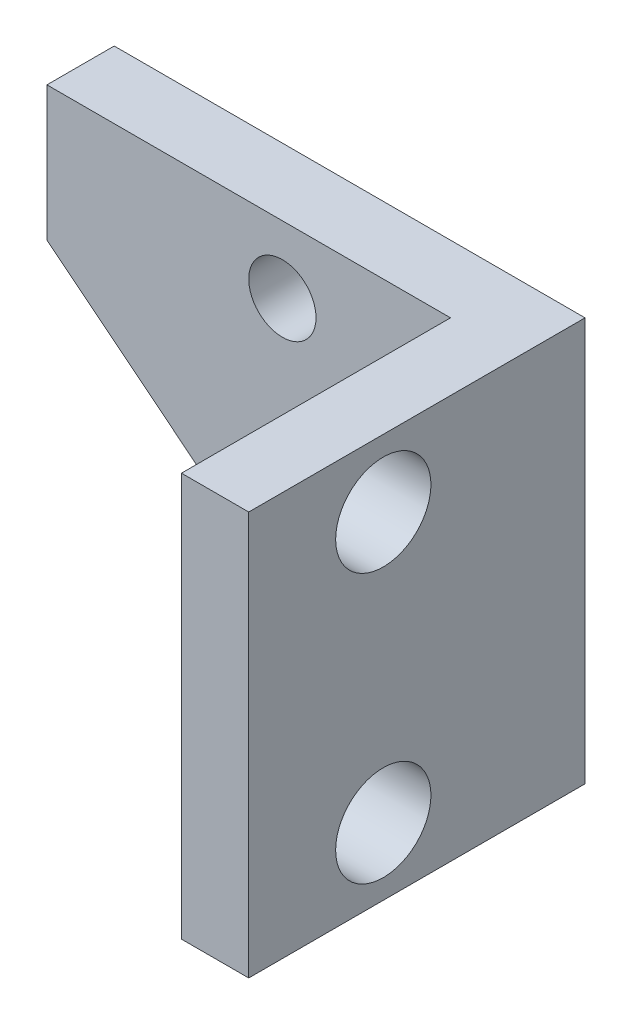
from build123d import *

# Parameters (mm, degrees)
BOSS_EXTRUDE1_DEPTH        = 3.175
F_1_8_0_1250_DOWEL_HOLE2_D = 3.175
BOSS_EXTRUDE2_START        = -3.175
SKETCH7_W                  = 3.175
SKETCH7_H                  = 19.05
BOSS_EXTRUDE2_DEPTH        = 15.875
F_8_CLEARANCE_HOLE1_D      = 4.4958


with BuildPart() as part:
    # Sketch1 → Boss-Extrude1 (new body)
    with BuildSketch(Plane.XY):
        Polygon((0, 0), (-22.225, 0), (-22.225, -6.35), (-6.35, -19.05), (0, -19.05), align=None)
    extrude(amount=BOSS_EXTRUDE1_DEPTH)

    # 1/8 (0.1250) Dowel Hole2 (through all)
    with Locations(Plane.XY.offset(3.175)):
        with Locations((-11.1125, -3.175)):
            Hole(F_1_8_0_1250_DOWEL_HOLE2_D / 2)

    # Sketch7 → Boss-Extrude2 (add)
    with BuildSketch(Plane.XY.offset(3.175).offset(BOSS_EXTRUDE2_START)):
        with Locations((-1.5875, -9.525)):
            Rectangle(SKETCH7_W, SKETCH7_H)
    extrude(amount=BOSS_EXTRUDE2_DEPTH)

    # #8 Clearance Hole1 (through all)
    with Locations(Plane.ZY.offset(3.175)):
        with Locations((9.525, -15.875), (9.525, -3.175)):
            Hole(F_8_CLEARANCE_HOLE1_D / 2)


solid = part.part
